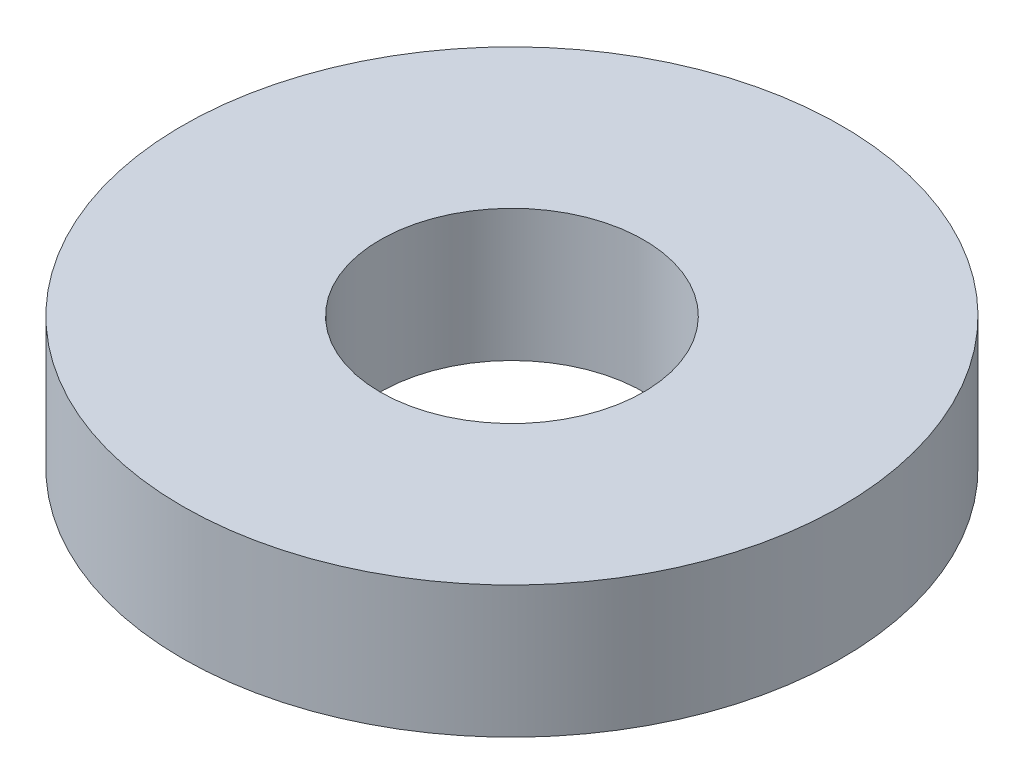
from build123d import *

# Parameters (mm, degrees)
SKETCH1_R           = 25
SKETCH1_R_2         = 10
BOSS_EXTRUDE1_DEPTH = 10


with BuildPart() as part:
    # Sketch1 → Boss-Extrude1 (new body)
    with BuildSketch(Plane(origin=(0, 0, 0), x_dir=(1, 0, 0), z_dir=(0, 1, 0))):
        with Locations(Location((0, 0, 0), (0, 0, 270))):
            Circle(SKETCH1_R)
        with Locations(Location((0, 0, 0), (0, 0, 270))):
            Circle(SKETCH1_R_2, mode=Mode.SUBTRACT)
    extrude(amount=BOSS_EXTRUDE1_DEPTH)


solid = part.part
